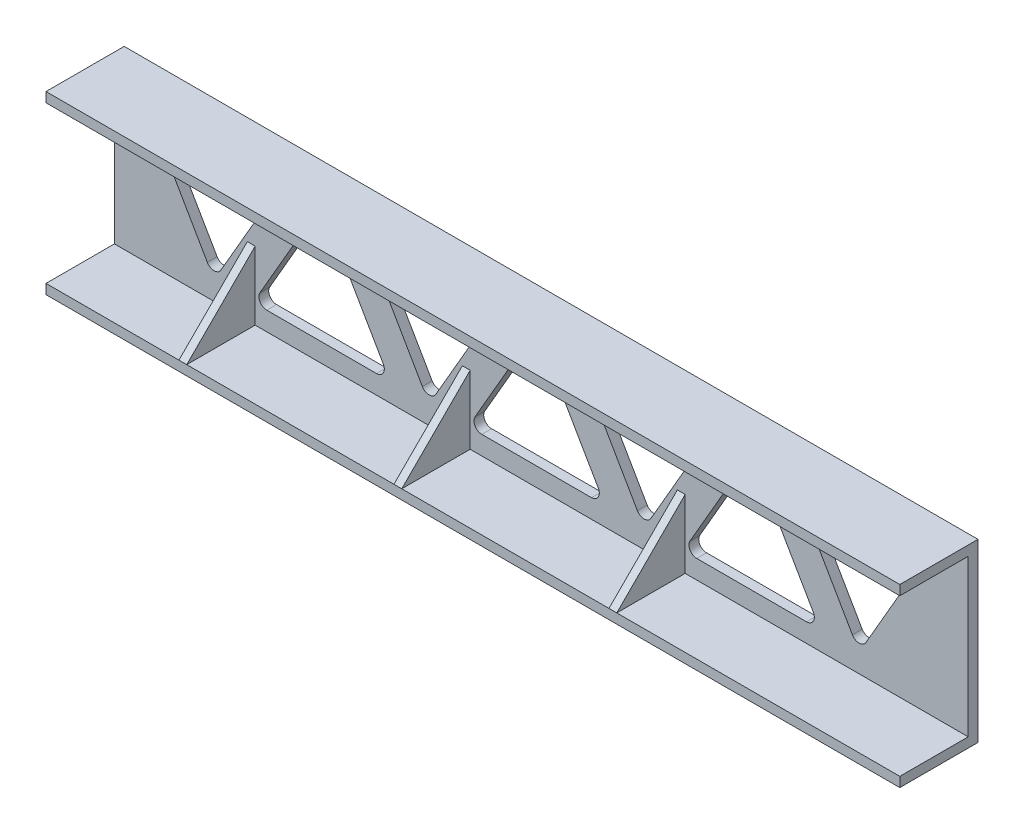
from build123d import *

# Parameters (mm, degrees)
SKETCH1_W           = 277.368
SKETCH1_H           = 57.15
BOSS_EXTRUDE1_DEPTH = 3.175
SKETCH2_W           = 277.368
SKETCH2_H           = 25.4
BOSS_EXTRUDE2_DEPTH = 3.175
SKETCH3_W           = 277.368
SKETCH3_H           = 25.4
BOSS_EXTRUDE3_DEPTH = 3.175
BOSS_EXTRUDE4_DEPTH = 2.54
BOSS_EXTRUDE5_DEPTH = 2.54
BOSS_EXTRUDE6_DEPTH = 2.54
BOSS_EXTRUDE7_DEPTH = 2.54
BOSS_EXTRUDE8_DEPTH = 2.54
BOSS_EXTRUDE9_DEPTH = 2.54


with BuildPart() as part:
    # Sketch1 → Boss-Extrude1 (new body)
    with BuildSketch(Plane.XY):
        with Locations((138.684, 28.575)):
            Rectangle(SKETCH1_W, SKETCH1_H)
        with BuildLine():
            Line((30.185295474, 13.081), (12.359704526, 43.955829198))
            ThreePointArc((12.359704526, 43.955829198), (12.359704526, 46.495829198), (14.559409051, 47.765829198))
            Line((14.559409051, 47.765829198), (50.210590949, 47.765829198))
            ThreePointArc((50.210590949, 47.765829198), (52.410295474, 46.495829198), (52.410295474, 43.955829198))
            Line((52.410295474, 43.955829198), (34.584704526, 13.081))
            ThreePointArc((34.584704526, 13.081), (32.385, 11.811), (30.185295474, 13.081))
        make_face(mode=Mode.SUBTRACT)
        with BuildLine():
            Line((49.484409051, 9.271), (85.135590949, 9.271))
            ThreePointArc((85.135590949, 9.271), (87.335295474, 10.541), (87.335295474, 13.081))
            Line((87.335295474, 13.081), (69.509704526, 43.955829198))
            ThreePointArc((69.509704526, 43.955829198), (67.31, 45.225829198), (65.110295474, 43.955829198))
            Line((65.110295474, 43.955829198), (47.284704526, 13.081))
            ThreePointArc((47.284704526, 13.081), (47.284704526, 10.541), (49.484409051, 9.271))
        make_face(mode=Mode.SUBTRACT)
        with BuildLine():
            Line((100.035295474, 13.081), (82.209704526, 43.955829198))
            ThreePointArc((82.209704526, 43.955829198), (82.209704526, 46.495829198), (84.409409051, 47.765829198))
            Line((84.409409051, 47.765829198), (120.060590949, 47.765829198))
            ThreePointArc((120.060590949, 47.765829198), (122.260295474, 46.495829198), (122.260295474, 43.955829198))
            Line((122.260295474, 43.955829198), (104.434704526, 13.081))
            ThreePointArc((104.434704526, 13.081), (102.235, 11.811), (100.035295474, 13.081))
        make_face(mode=Mode.SUBTRACT)
        with BuildLine():
            Line((119.334409051, 9.271), (154.985590949, 9.271))
            ThreePointArc((154.985590949, 9.271), (157.185295474, 10.541), (157.185295474, 13.081))
            Line((157.185295474, 13.081), (139.359704526, 43.955829198))
            ThreePointArc((139.359704526, 43.955829198), (137.16, 45.225829198), (134.960295474, 43.955829198))
            Line((134.960295474, 43.955829198), (117.134704526, 13.081))
            ThreePointArc((117.134704526, 13.081), (117.134704526, 10.541), (119.334409051, 9.271))
        make_face(mode=Mode.SUBTRACT)
        with BuildLine():
            Line((169.885295474, 13.081), (152.059704526, 43.955829198))
            ThreePointArc((152.059704526, 43.955829198), (152.059704526, 46.495829198), (154.259409051, 47.765829198))
            Line((154.259409051, 47.765829198), (189.910590949, 47.765829198))
            ThreePointArc((189.910590949, 47.765829198), (192.110295474, 46.495829198), (192.110295474, 43.955829198))
            Line((192.110295474, 43.955829198), (174.284704526, 13.081))
            ThreePointArc((174.284704526, 13.081), (172.085, 11.811), (169.885295474, 13.081))
        make_face(mode=Mode.SUBTRACT)
        with BuildLine():
            Line((189.184409051, 9.271), (224.835590949, 9.271))
            ThreePointArc((224.835590949, 9.271), (227.035295474, 10.541), (227.035295474, 13.081))
            Line((227.035295474, 13.081), (209.209704526, 43.955829198))
            ThreePointArc((209.209704526, 43.955829198), (207.01, 45.225829198), (204.810295474, 43.955829198))
            Line((204.810295474, 43.955829198), (186.984704526, 13.081))
            ThreePointArc((186.984704526, 13.081), (186.984704526, 10.541), (189.184409051, 9.271))
        make_face(mode=Mode.SUBTRACT)
        with BuildLine():
            Line((239.735295474, 13.081), (221.909704526, 43.955829198))
            ThreePointArc((221.909704526, 43.955829198), (221.909704526, 46.495829198), (224.109409051, 47.765829198))
            Line((224.109409051, 47.765829198), (259.760590949, 47.765829198))
            ThreePointArc((259.760590949, 47.765829198), (261.960295474, 46.495829198), (261.960295474, 43.955829198))
            Line((261.960295474, 43.955829198), (244.134704526, 13.081))
            ThreePointArc((244.134704526, 13.081), (241.935, 11.811), (239.735295474, 13.081))
        make_face(mode=Mode.SUBTRACT)
    extrude(amount=BOSS_EXTRUDE1_DEPTH)

    # Sketch2 → Boss-Extrude2 (add)
    with BuildSketch(Plane(origin=(0, 57.15, 0), x_dir=(1, 0, 0), z_dir=(0, 1, 0))):
        with Locations((138.684, -12.7)):
            Rectangle(SKETCH2_W, SKETCH2_H)
    extrude(amount=-BOSS_EXTRUDE2_DEPTH)

    # Sketch3 → Boss-Extrude3 (add)
    with BuildSketch(Plane.XZ):
        with Locations((138.684, 12.7)):
            Rectangle(SKETCH3_W, SKETCH3_H)
    extrude(amount=-BOSS_EXTRUDE3_DEPTH)

    # Sketch5 → Boss-Extrude4 (add)
    with BuildSketch(Plane.YZ.offset(43.18)):
        Polygon((3.175, 3.175), (3.175, 25.4), (25.4, 3.175), align=None)
    extrude(amount=BOSS_EXTRUDE4_DEPTH)

    # Sketch6 → Boss-Extrude5 (add)
    with BuildSketch(Plane.YZ.offset(113.03)):
        Polygon((3.175, 25.4), (3.175, 3.175), (25.4, 3.175), align=None)
    extrude(amount=BOSS_EXTRUDE5_DEPTH)

    # Sketch7 → Boss-Extrude6 (add)
    with BuildSketch(Plane.YZ.offset(182.88)):
        Polygon((3.175, 25.4), (3.175, 3.175), (25.4, 3.175), align=None)
    extrude(amount=BOSS_EXTRUDE6_DEPTH)

    # Sketch8 → Boss-Extrude7 (add)
    with BuildSketch(Plane(origin=(76.708, 0, 0), x_dir=(0, -1, 0), z_dir=(-1, 0, 0))):
        Polygon((-53.975, 3.175), (-53.975, 25.4), (-31.75, 3.175), align=None)
    extrude(amount=-BOSS_EXTRUDE7_DEPTH)

    # Sketch9 → Boss-Extrude8 (add)
    with BuildSketch(Plane(origin=(146.558, 0, 0), x_dir=(0, -1, 0), z_dir=(-1, 0, 0))):
        Polygon((-53.975, 25.4), (-53.975, 3.175), (-31.75, 3.175), align=None)
    extrude(amount=-BOSS_EXTRUDE8_DEPTH)

    # Sketch10 → Boss-Extrude9 (add)
    with BuildSketch(Plane(origin=(216.408, 0, 0), x_dir=(0, -1, 0), z_dir=(-1, 0, 0))):
        Polygon((-53.975, 25.4), (-53.975, 3.175), (-31.75, 3.175), align=None)
    extrude(amount=-BOSS_EXTRUDE9_DEPTH)


solid = part.part
